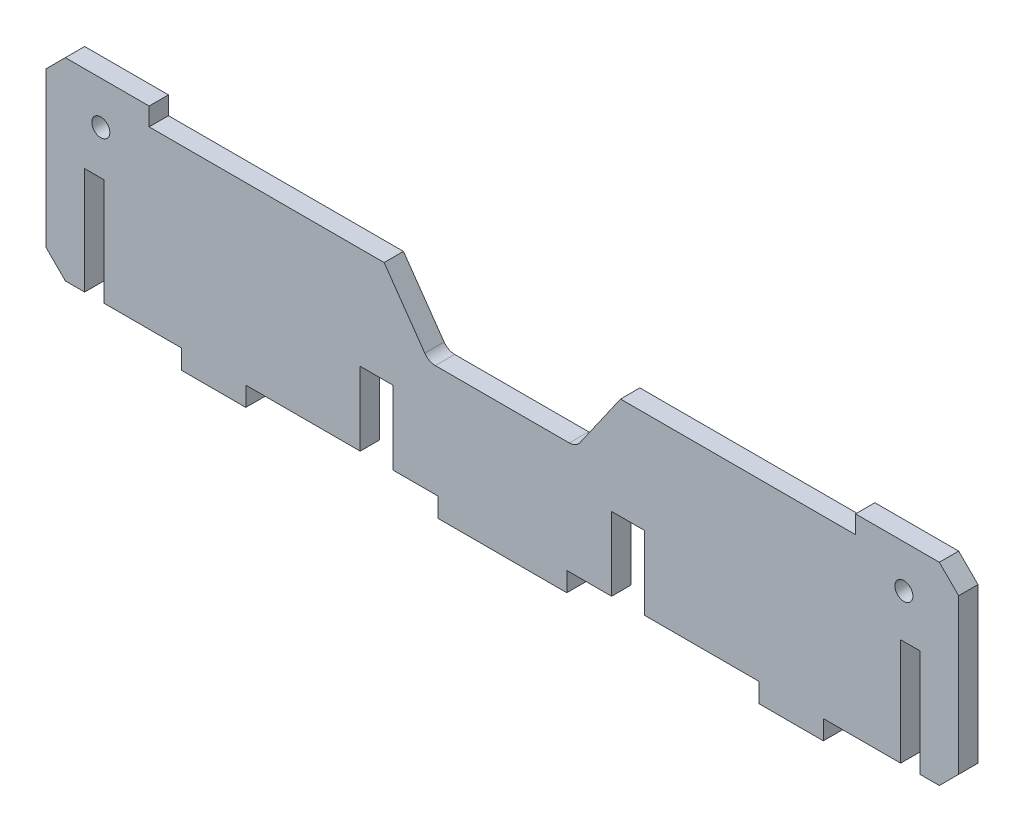
from build123d import *

# Parameters (mm, degrees)
SKETCH_1_R          = 1.4
SKETCH_1_W          = 3
SKETCH_1_H          = 12
EXTRUDE_1_DEPTH     = 3
SKETCH_2_W          = 20
SKETCH_2_H          = 3
EXTRUDE_2_DEPTH     = 2.8
SKETCH_3_W          = 3
SKETCH_3_H          = 12
EXTRUDE_3_DEPTH     = 3
SKETCH_4_W          = 3
SKETCH_4_H          = 3.946305982
CUT_EXTRUDE_1_DEPTH = 3
SKETCH_5_W          = 3
SKETCH_5_H          = 3
CUT_EXTRUDE_2_DEPTH = 1
SKETCH_7_W          = 3
SKETCH_7_H          = 2.8
CUT_EXTRUDE_4_DEPTH = 60
CUT_EXTRUDE_5_DEPTH = 60
EXTRUDE_4_DEPTH     = 3
FILLET_1_R          = 3
EXTRUDE_START       = -3
EXTRUDE_5_DEPTH     = 3
CUT_EXTRUDE_7_DEPTH = 10


with BuildPart() as part:
    # 草图1 → 凸台-拉伸1 (new body)
    with BuildSketch(Plane.XY):
        Polygon((-54.8, 15.675), (-67.8, 15.675), (-70.8, 12.675), (-70.8, -11.325), (-67.8, -14.325), (-49.8, -14.325), (-49.8, -17.325), (-39.8, -17.325), (-39.8, -14.325), (-22, -14.325), (-22, -2.975), (-17, -2.970818371), (-17, -14.325), (-10, -14.325), (-10, -17.325), (10, -17.325), (10, -14.325), (17, -14.325), (17, -2.970818371), (22, -2.975), (22, -14.325), (39.8, -14.325), (39.8, -17.325), (49.8, -17.325), (49.8, -14.325), (67.8, -14.325), (70.8, -11.325), (70.8, 12.675), (67.8, 15.675), (54.8, 15.675), (54.8, 12.875), (29.8, 12.875), (29.8, 15.675), (10, 15.675), (10, 12.875), (-10, 12.875), (-10, 15.675), (-29.8, 15.675), (-29.8, 12.875), (-54.8, 12.875), align=None)
        with Locations((-62.3, 9.063133886)):
            Circle(SKETCH_1_R, mode=Mode.SUBTRACT)
        with Locations((62.3, 9.063133886)):
            Circle(SKETCH_1_R, mode=Mode.SUBTRACT)
        with Locations((-63.3, -0.325)):
            Rectangle(SKETCH_1_W, SKETCH_1_H, mode=Mode.SUBTRACT)
        with Locations((63.3, -0.325)):
            Rectangle(SKETCH_1_W, SKETCH_1_H, mode=Mode.SUBTRACT)
    extrude(amount=EXTRUDE_1_DEPTH)

    # 草图2 → 凸台-拉伸2 (add)
    with BuildSketch(Plane(origin=(0, 12.875, 0), x_dir=(1, 0, 0), z_dir=(0, 1, 0))):
        with Locations((0, -1.5)):
            Rectangle(SKETCH_2_W, SKETCH_2_H)
    extrude(amount=EXTRUDE_2_DEPTH)

    # 草图3 → 凸台-拉伸3 (add)
    with BuildSketch(Plane.XY.offset(3)):
        with Locations((-63.3, -0.325)):
            Rectangle(SKETCH_3_W, SKETCH_3_H)
        with Locations((63.3, -0.325)):
            Rectangle(SKETCH_3_W, SKETCH_3_H)
    extrude(amount=-EXTRUDE_3_DEPTH)

    # 草图4 → 切除-拉伸1 (cut)
    with BuildSketch(Plane(origin=(133.943153128, -125.945742166, 0), x_dir=(1, 0, 0), z_dir=(0, 0, -1))):
        Polygon((-72.143153128, -111.674436184), (-72.143153128, -127.209199434), (-69.143153128, -127.209199434), (-69.143153128, -111.674436184), (-69.143153128, -111.620742166), (-72.143153128, -111.620742166), align=None)
        with Locations((-70.643153128, -109.647589175)):
            Rectangle(SKETCH_4_W, SKETCH_4_H)
    cut_extrude_1 = extrude(amount=-CUT_EXTRUDE_1_DEPTH, mode=Mode.SUBTRACT)

    # 镜向1: 切除-拉伸1 across plane
    add(cut_extrude_1.mirror(Plane.ZY), mode=Mode.SUBTRACT)

    # 草图5 → 切除-拉伸2 (cut)
    with BuildSketch(Plane.XZ.offset(-1.263457268)):
        with Locations((63.3, 1.5)):
            Rectangle(SKETCH_5_W, SKETCH_5_H)
        with Locations((-63.3, 1.5)):
            Rectangle(SKETCH_5_W, SKETCH_5_H)
    extrude(amount=-CUT_EXTRUDE_2_DEPTH, mode=Mode.SUBTRACT)

    # 草图7 → 切除-拉伸4 (cut)
    with BuildSketch(Plane(origin=(29.8, 0, 0), x_dir=(0, 0, -1), z_dir=(1, 0, 0))):
        with Locations((-1.5, 14.275)):
            Rectangle(SKETCH_7_W, SKETCH_7_H)
    extrude(amount=-CUT_EXTRUDE_4_DEPTH, mode=Mode.SUBTRACT)

    # 草图8 → 切除-拉伸5 (cut)
    with BuildSketch(Plane(origin=(0, 0, 0), x_dir=(-1, 0, 0), z_dir=(0, 0, -1))):
        Polygon((-8, 0), (-13, 0), (-22, 12.875), (-17, 12.875), (17, 12.875), (22, 12.875), (13, 0), (8, 0), (0, 0), align=None)
    extrude(amount=-CUT_EXTRUDE_5_DEPTH, mode=Mode.SUBTRACT)

    # 草图10 → 凸台-拉伸4 (add)
    with BuildSketch(Plane(origin=(0, 0, 0), x_dir=(-1, 0, 0), z_dir=(0, 0, -1))):
        Polygon((-22, 12.875), (-13, 0), (13, 0), (22, 12.875), (19.559801877, 12.875), (11.95786013, 2), (-11.95786013, 2), (-19.559801877, 12.875), align=None)
    extrude(amount=-EXTRUDE_4_DEPTH)

    # 圆角1
    fillet_1_edges = [part.edges().sort_by_distance(p)[0] for p in [
        (-11.95786013, 2, 1.5),
        (11.95786013, 2, 1.5),
    ]]
    fillet(fillet_1_edges, radius=FILLET_1_R)

    # 草图11 → 凸台-拉伸5 (add)
    with BuildSketch(Plane(origin=(0, 0, 0), x_dir=(-1, 0, 0), z_dir=(0, 0, -1)).offset(EXTRUDE_START)):
        with BuildLine():
            Line((-12.853467068, 3.281215481), (-19.559801877, 12.875))
            Line((-19.559801877, 12.875), (-18.339702816, 12.875))
            Line((-18.339702816, 12.875), (-12.033861487, 3.854143654))
            ThreePointArc((-12.033861487, 3.854143654), (-11.31884925, 3.226343791), (-10.394650325, 3))
            Line((-10.394650325, 3), (10.394650325, 3))
            ThreePointArc((10.394650325, 3), (11.31884925, 3.226343791), (12.033861487, 3.854143654))
            Line((12.033861487, 3.854143654), (18.339702816, 12.875))
            Line((18.339702816, 12.875), (19.559801877, 12.875))
            Line((19.559801877, 12.875), (12.853467068, 3.281215481))
            ThreePointArc((12.853467068, 3.281215481), (11.780948713, 2.339515687), (10.394650325, 2))
            Line((10.394650325, 2), (-10.394650325, 2))
            ThreePointArc((-10.394650325, 2), (-11.780948713, 2.339515687), (-12.853467068, 3.281215481))
        make_face()
    extrude(amount=EXTRUDE_5_DEPTH)

    # 草图12 → 切除-拉伸7 (cut)
    with BuildSketch(Plane(origin=(0, 0, 0), x_dir=(-1, 0, 0), z_dir=(0, 0, -1))):
        Polygon((-22, -2.975), (-22, -14.325), (-22.05, -14.325), (-22.05, -2.925041799), (-16.95, -2.920776537), (-16.95, -14.325), (-17, -14.325), (-17, -2.970818371), align=None)
        Polygon((17, -2.970818371), (17, -14.325), (16.95, -14.325), (16.95, -2.920776537), (22.05, -2.925041799), (22.05, -14.325), (22, -14.325), (22, -2.975), align=None)
    extrude(amount=-CUT_EXTRUDE_7_DEPTH, mode=Mode.SUBTRACT)


solid = part.part
